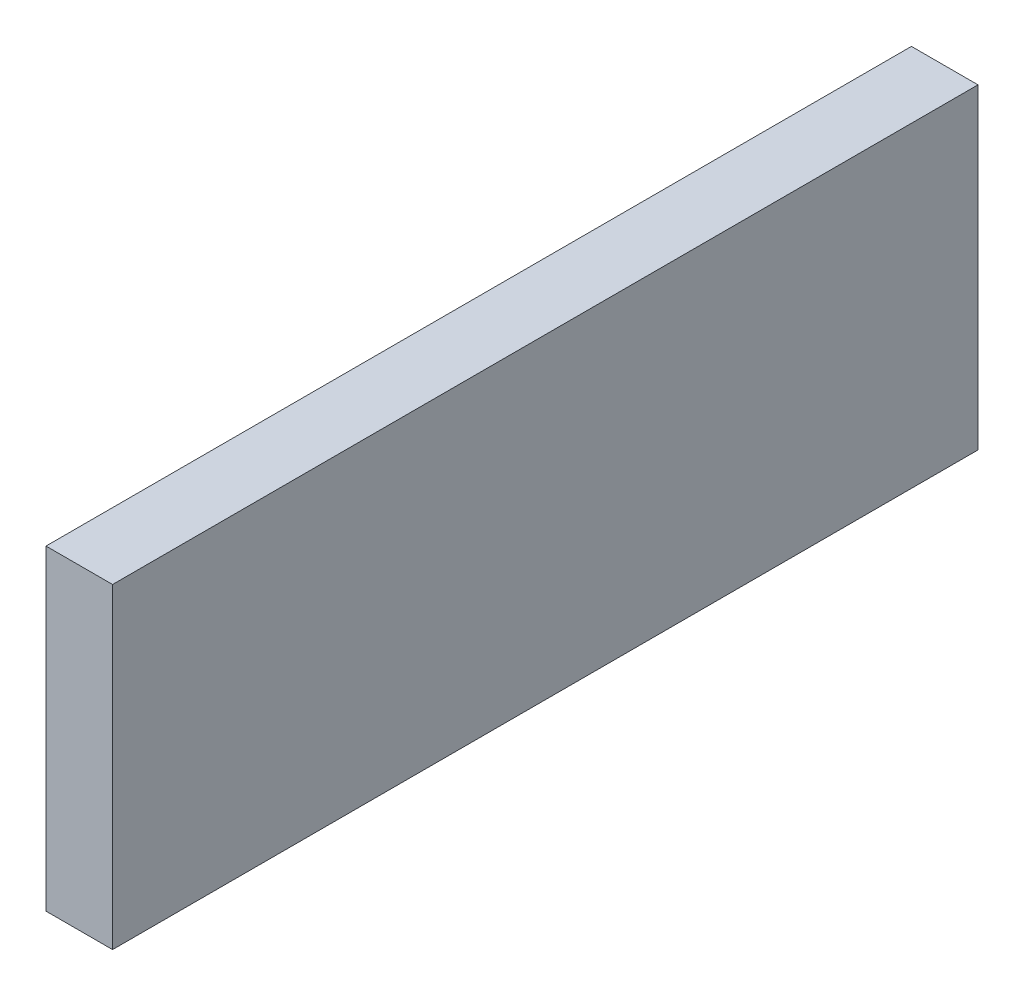
from build123d import *

# Parameters (mm, degrees)
SKETCH1_W      = 25.4
SKETCH1_H      = 120.65
EXTRUDE1_DEPTH = 330.2


with BuildPart() as part:
    # Sketch1 → Extrude1 (new body)
    with BuildSketch(Plane.XY):
        with Locations((0, 60.325)):
            Rectangle(SKETCH1_W, SKETCH1_H)
    extrude(amount=-EXTRUDE1_DEPTH)


solid = part.part
